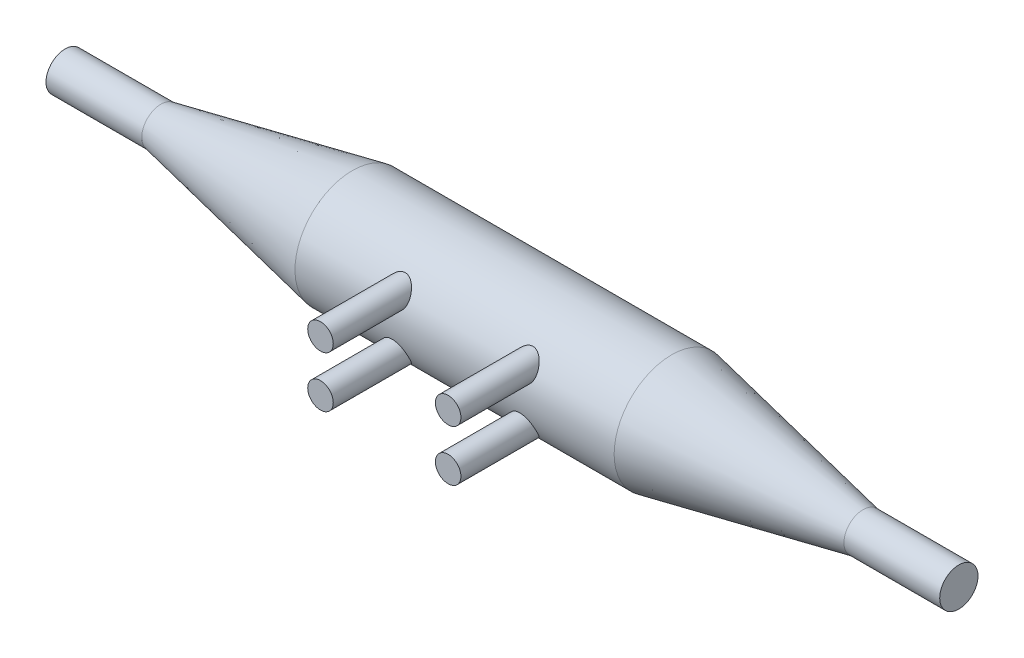
from build123d import *

# Parameters (mm, degrees)
SKETCH2_R           = 2
BOSS_EXTRUDE1_DEPTH = 20


with BuildPart() as part:
    # Sketch1 → Revolve1 (revolve)
    with BuildSketch(Plane.XY):
        Polygon((-16.740830618, 3), (-1.740830618, 3), (28.259169382, 9), (78.259169382, 9), (108.259169382, 3), (123.259169382, 3), (123.259169382, 0), (-16.740830618, 0), align=None)
    revolve(axis=Axis((123.259169382, 0, 0), (-1, 0, 0)))

    # Sketch2 → Boss-Extrude1 (add)
    with BuildSketch(Plane.XY):
        with Locations(Location((43.259169382, 4, 0), (0, 0, 180))):
            Circle(SKETCH2_R)
        with Locations(Location((43.259169382, -4, 0), (0, 0, 180))):
            Circle(SKETCH2_R)
        with Locations(Location((63.259169382, 4, 0), (0, 0, 180))):
            Circle(SKETCH2_R)
        with Locations(Location((63.259169382, -4, 0), (0, 0, 180))):
            Circle(SKETCH2_R)
    extrude(amount=BOSS_EXTRUDE1_DEPTH)


solid = part.part
